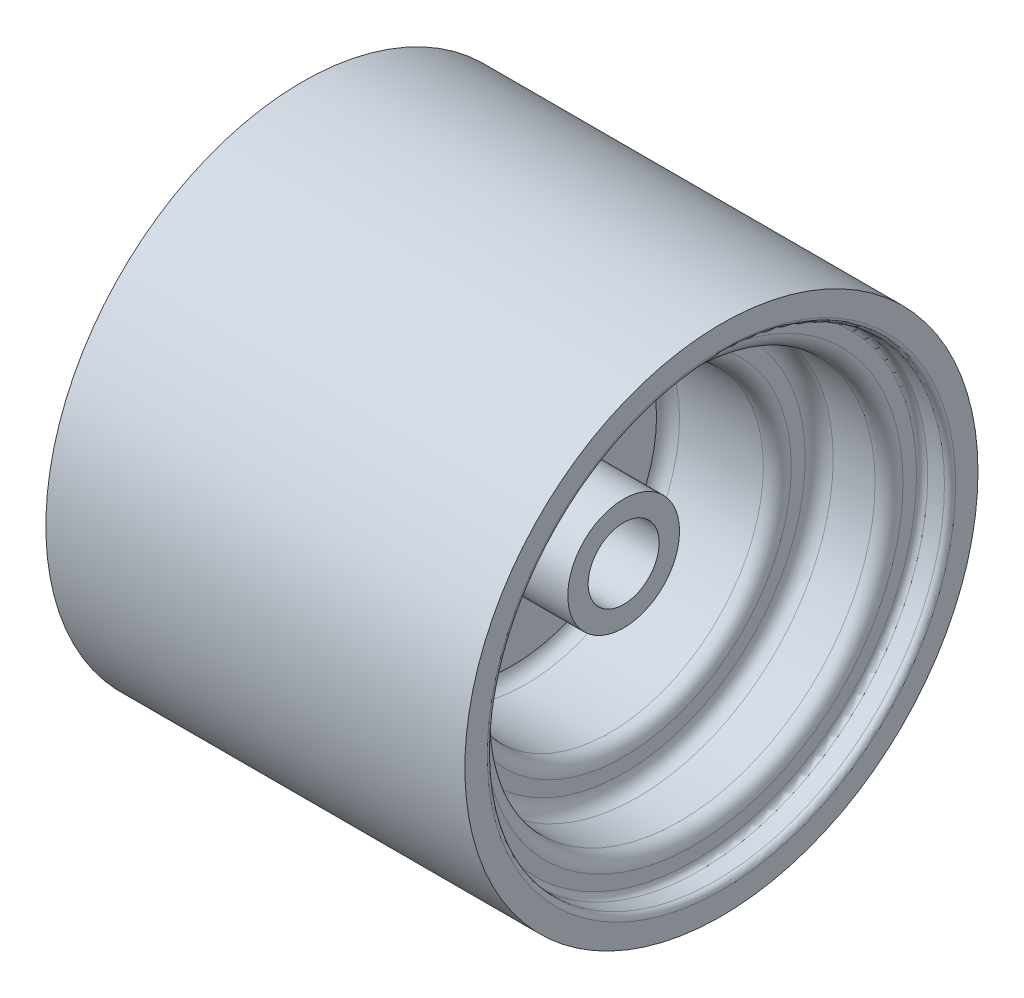
from build123d import *

# Parameters (mm, degrees)
SKETCH1_R           = 91.845
BOSS_EXTRUDE1_DEPTH = 150.24
SKETCH2_R           = 81.845
CUT_EXTRUDE1_DEPTH  = 10
SKETCH3_R           = 70
CUT_EXTRUDE2_DEPTH  = 25
SKETCH4_R           = 55
CUT_EXTRUDE3_DEPTH  = 40
SKETCH5_R           = 20
BOSS_EXTRUDE3_DEPTH = 40
SKETCH6_R           = 91.845
CUT_EXTRUDE4_DEPTH  = 75
FILLET1_R           = 2
FILLET2_R           = 5
FILLET3_R           = 5
FILLET4_R           = 2
FILLET5_R           = 5
FILLET6_R           = 5
FILLET7_R           = 2
SKETCH7_R           = 12.7
CUT_EXTRUDE5_DEPTH  = 75


with BuildPart() as part:
    # Sketch1 → Boss-Extrude1 (new body)
    with BuildSketch(Plane(origin=(0, 0, 0), x_dir=(0, 0, -1), z_dir=(1, 0, 0))):
        Circle(SKETCH1_R)
    extrude(amount=BOSS_EXTRUDE1_DEPTH)

    # Sketch2 → Cut-Extrude1 (cut)
    with BuildSketch(Plane(origin=(150.24, 0, 0), x_dir=(0, 0, -1), z_dir=(1, 0, 0))):
        Circle(SKETCH2_R)
    extrude(amount=-CUT_EXTRUDE1_DEPTH, mode=Mode.SUBTRACT)

    # Sketch3 → Cut-Extrude2 (cut)
    with BuildSketch(Plane(origin=(140.24, 0, 0), x_dir=(0, 0, -1), z_dir=(1, 0, 0))):
        Circle(SKETCH3_R)
    extrude(amount=-CUT_EXTRUDE2_DEPTH, mode=Mode.SUBTRACT)

    # Sketch4 → Cut-Extrude3 (cut)
    with BuildSketch(Plane(origin=(115.24, 0, 0), x_dir=(0, 0, -1), z_dir=(1, 0, 0))):
        Circle(SKETCH4_R)
    extrude(amount=-CUT_EXTRUDE3_DEPTH, mode=Mode.SUBTRACT)

    # Sketch5 → Boss-Extrude3 (add)
    with BuildSketch(Plane(origin=(75.24, 0, 0), x_dir=(0, 0, -1), z_dir=(1, 0, 0))):
        Circle(SKETCH5_R)
    extrude(amount=BOSS_EXTRUDE3_DEPTH)

    # Sketch6 → Cut-Extrude4 (cut)
    with BuildSketch(Plane.ZY):
        Circle(SKETCH6_R)
    extrude(amount=-CUT_EXTRUDE4_DEPTH, mode=Mode.SUBTRACT)

    # Fillet1
    fillet1_edges = [part.edges().sort_by_distance(p)[0] for p in [
        (150.24, 0, 81.845),
    ]]
    fillet(fillet1_edges, radius=FILLET1_R)

    # Fillet2
    fillet2_edges = [part.edges().sort_by_distance(p)[0] for p in [
        (140.24, 0, 70),
    ]]
    fillet(fillet2_edges, radius=FILLET2_R)

    # Fillet3
    fillet3_edges = [part.edges().sort_by_distance(p)[0] for p in [
        (115.24, 0, 70),
    ]]
    fillet(fillet3_edges, radius=FILLET3_R)

    # Fillet4
    fillet4_edges = [part.edges().sort_by_distance(p)[0] for p in [
        (140.24, 0, 81.845),
    ]]
    fillet(fillet4_edges, radius=FILLET4_R)

    # Fillet5
    fillet5_edges = [part.edges().sort_by_distance(p)[0] for p in [
        (115.24, 0, 55),
    ]]
    fillet(fillet5_edges, radius=FILLET5_R)

    # Fillet6
    fillet6_edges = [part.edges().sort_by_distance(p)[0] for p in [
        (75.24, 0, 55),
    ]]
    fillet(fillet6_edges, radius=FILLET6_R)

    # Fillet7
    fillet7_edges = [part.edges().sort_by_distance(p)[0] for p in [
        (75.24, 0, 20),
    ]]
    fillet(fillet7_edges, radius=FILLET7_R)

    # Sketch7 → Cut-Extrude5 (cut)
    with BuildSketch(Plane(origin=(115.24, 0, 0), x_dir=(0, 0, -1), z_dir=(1, 0, 0))):
        Circle(SKETCH7_R)
    extrude(amount=-CUT_EXTRUDE5_DEPTH, mode=Mode.SUBTRACT)

    # Mirror9: part across plane


with BuildPart() as part_1:
    add(part.part)
    add(part.part.mirror(Plane(origin=(75.24, 0, 0), x_dir=(0, 0, 1), z_dir=(1, 0, 0))))


solid = part_1.part
